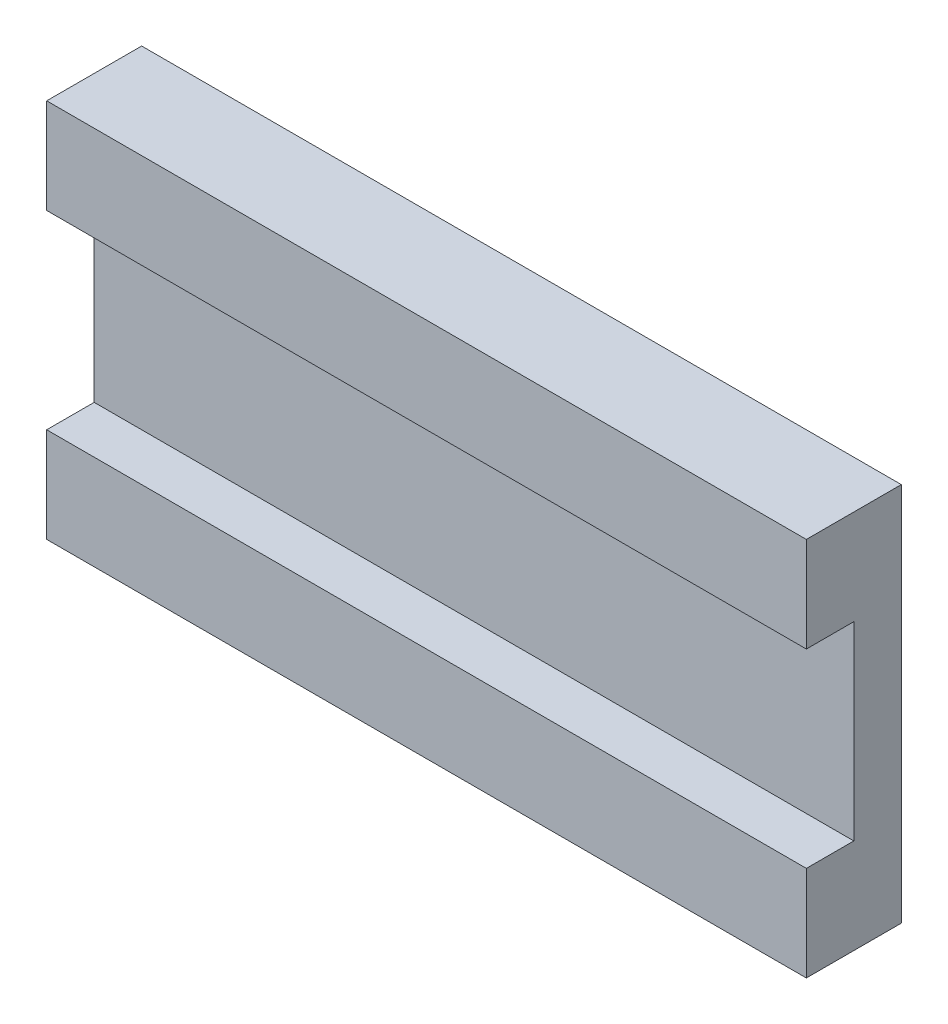
from build123d import *

# Parameters (mm, degrees)
BOSS_EXTRUDE1_DEPTH = 160


with BuildPart() as part:
    # Sketch2 → Boss-Extrude1 (new body)
    with BuildSketch(Plane(origin=(0, 0, 0), x_dir=(0, 0, -1), z_dir=(1, 0, 0))):
        Polygon((0, -35.093884413), (0, 44.906115587), (-20, 44.906115587), (-20, 24.906115587), (-10, 24.906115587), (-10, -15.093884413), (-20, -15.093884413), (-20, -35.093884413), align=None)
    extrude(amount=-BOSS_EXTRUDE1_DEPTH)


solid = part.part
